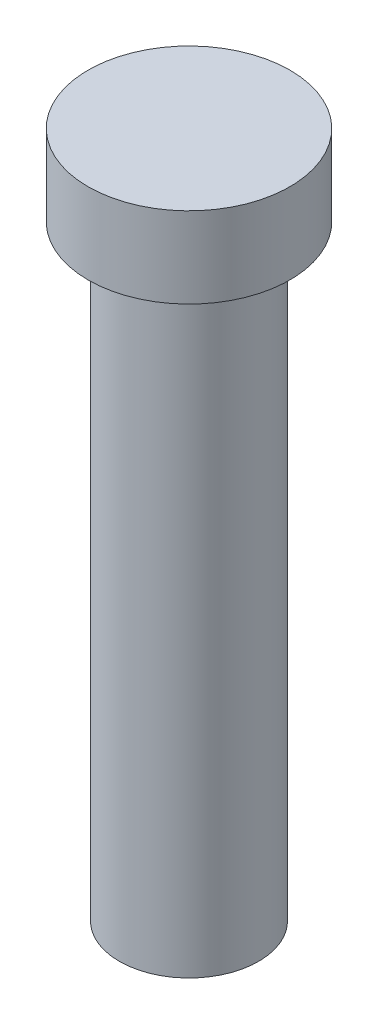
from build123d import *

# Parameters (mm, degrees)
SKETCH1_R           = 3.45
BOSS_EXTRUDE1_DEPTH = 30
SKETCH2_R           = 5
BOSS_EXTRUDE2_DEPTH = 4


with BuildPart() as part:
    # Sketch1 → Boss-Extrude1 (new body)
    with BuildSketch(Plane(origin=(0, 0, 0), x_dir=(1, 0, 0), z_dir=(0, 1, 0))):
        with Locations(Location((0, 0, 0), (0, 0, 270))):
            Circle(SKETCH1_R)
    extrude(amount=BOSS_EXTRUDE1_DEPTH)

    # Sketch2 → Boss-Extrude2 (add)
    with BuildSketch(Plane(origin=(0, 30, 0), x_dir=(1, 0, 0), z_dir=(0, 1, 0))):
        with Locations(Location((0, 0, 0), (0, 0, 270))):
            Circle(SKETCH2_R)
    extrude(amount=BOSS_EXTRUDE2_DEPTH)


solid = part.part
